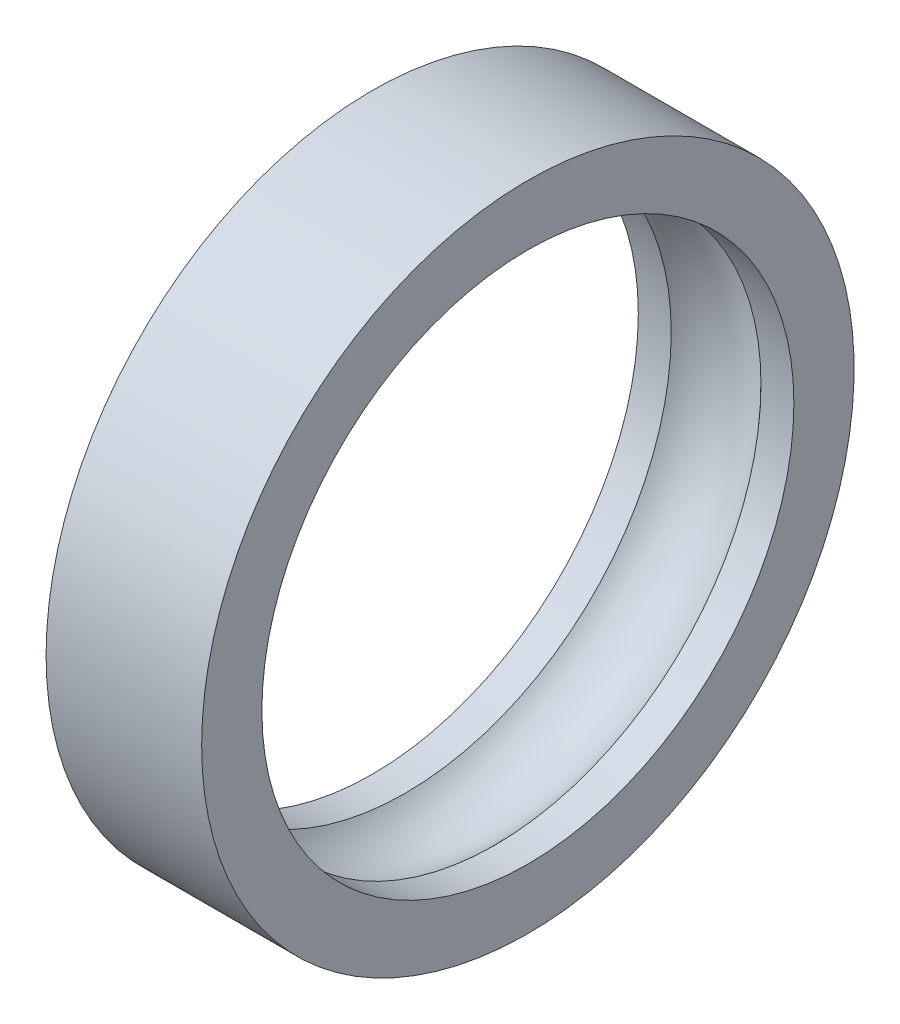
from build123d import *


with BuildPart() as part:
    # Sketch1 → Revolve1 (revolve)
    with BuildSketch(Plane.XY, mode=Mode.PRIVATE) as revolve1_sk:
        with BuildLine():
            ThreePointArc((4.472135955, 26.5), (0, 28.5), (-4.472135955, 26.5))
            Line((-4.472135955, 26.5), (-7.75, 26.5))
            Line((-7.75, 26.5), (-7.75, 32.5))
            Line((-7.75, 32.5), (7.75, 32.5))
            Line((7.75, 32.5), (7.75, 26.5))
            Line((7.75, 26.5), (4.472135955, 26.5))
        make_face()
    revolve(revolve1_sk.sketch.rotate(Axis((0, 0, 0), (1, 0, 0)), 90), axis=Axis((0, 0, 0), (1, 0, 0)))


solid = part.part
